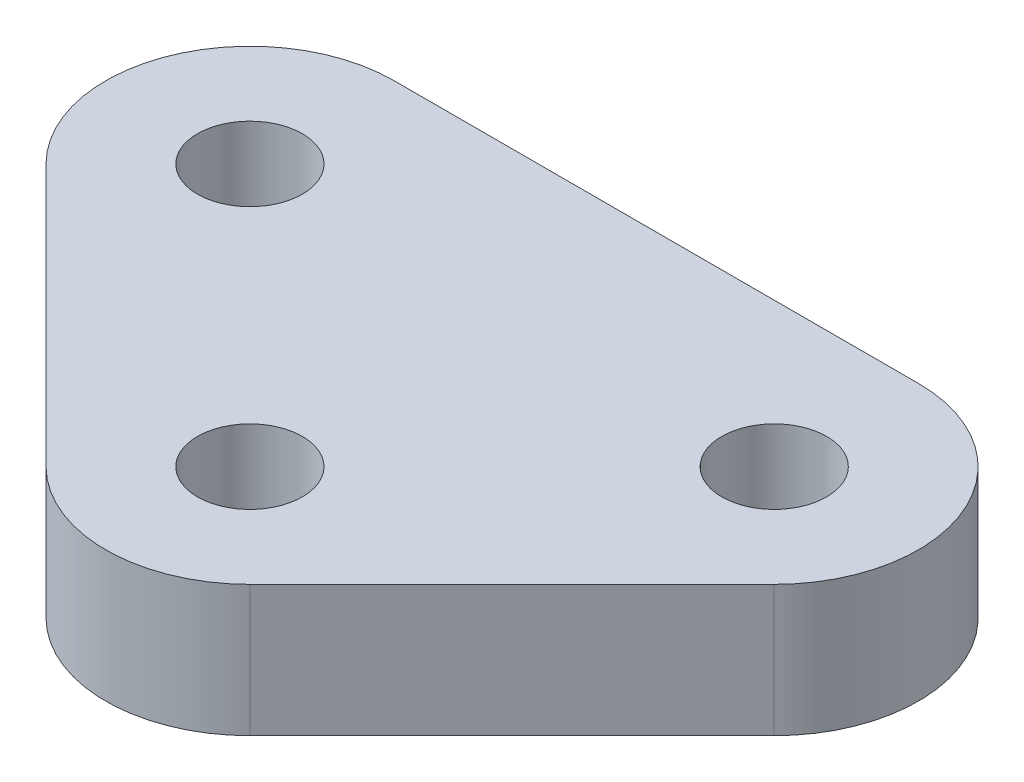
from build123d import *

# Parameters (mm, degrees)
SKETCH1_R           = 2
BOSS_EXTRUDE1_DEPTH = 5


with BuildPart() as part:
    # Sketch1 → Boss-Extrude1 (new body)
    with BuildSketch(Plane(origin=(0, 0, 0), x_dir=(1, 0, 0), z_dir=(0, 1, 0))):
        with BuildLine():
            Line((-10, 5.5), (10, 5.5))
            ThreePointArc((10, 5.5), (15.081337429, 2.104758878), (13.889087297, -3.889087297))
            Line((13.889087297, -3.889087297), (3.889087297, -13.889087297))
            ThreePointArc((3.889087297, -13.889087297), (0, -15.5), (-3.889087297, -13.889087297))
            Line((-3.889087297, -13.889087297), (-13.889087297, -3.889087297))
            ThreePointArc((-13.889087297, -3.889087297), (-15.081337429, 2.104758878), (-10, 5.5))
        make_face()
        with Locations(Location((-10, 0, 0), (0, 0, 270))):
            Circle(SKETCH1_R, mode=Mode.SUBTRACT)
        with Locations(Location((10, 0, 0), (0, 0, 270))):
            Circle(SKETCH1_R, mode=Mode.SUBTRACT)
        with Locations(Location((0, -10, 0), (0, 0, 270))):
            Circle(SKETCH1_R, mode=Mode.SUBTRACT)
    extrude(amount=BOSS_EXTRUDE1_DEPTH)


solid = part.part
